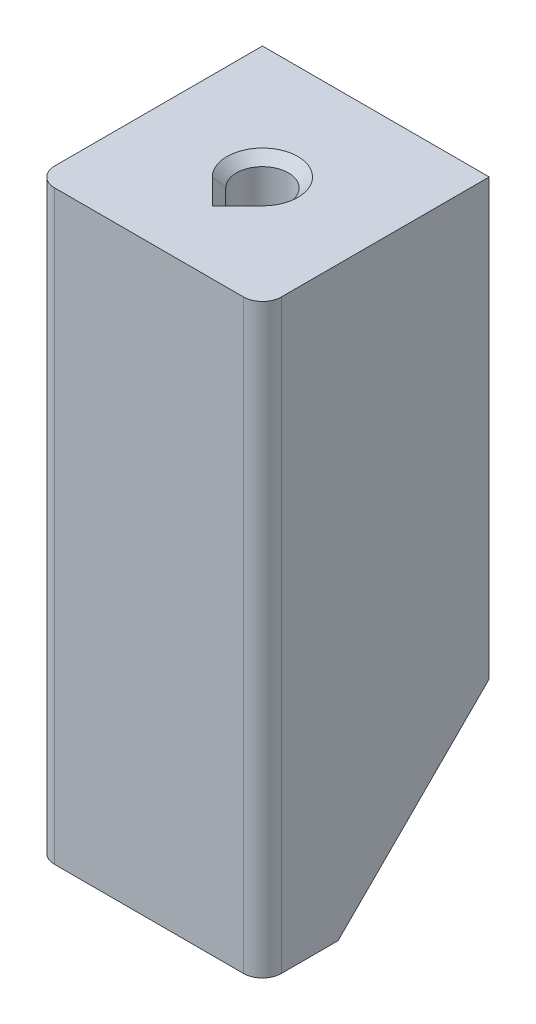
from build123d import *

# Parameters (mm, degrees)
BOSS_EXTRUDE1_DEPTH      = 12
BOSS_EXTRUDE1_DEPTH_BACK = 12
FILLET1_R                = 2
CUT_EXTRUDE1_DEPTH       = 66.1459899
CHAMFER1_SIZE            = 1


with BuildPart() as part:
    # Sketch3 → Boss-Extrude1 (new, two sides: drawn at the far end of the back side and taken through both)
    with BuildSketch(Plane(origin=(0, 0, 0), x_dir=(0, 0, -1), z_dir=(1, 0, 0)).offset(-BOSS_EXTRUDE1_DEPTH_BACK)):
        Polygon((0, 62), (-8, 62), (-8, 0), (0, 0), (16, 16), (16, 62), align=None)
    extrude(amount=BOSS_EXTRUDE1_DEPTH + BOSS_EXTRUDE1_DEPTH_BACK)

    # Fillet1
    fillet1_edges = [part.edges().sort_by_distance(p)[0] for p in [
        (-12, 31, 8),
        (12, 31, 8),
    ]]
    fillet(fillet1_edges, radius=FILLET1_R)

    # Sketch4 → Cut-Extrude1 (cut, through all)
    with BuildSketch(Plane(origin=(0, 62, 0), x_dir=(1, 0, 0), z_dir=(0, 1, 0))):
        with BuildLine():
            Line((0, 0.110912703), (1.944543648, 2.055456352))
            ThreePointArc((1.944543648, 2.055456352), (0, 6.75), (-1.944543648, 2.055456352))
            Line((-1.944543648, 2.055456352), (0, 0.110912703))
        make_face()
    extrude(amount=-CUT_EXTRUDE1_DEPTH, mode=Mode.SUBTRACT)

    # Chamfer1
    chamfer1_edges = [part.edges().sort_by_distance(p)[0] for p in [
        (0.972271824, 62, -1.083184528),
        (-0.972271824, 62, -1.083184528),
        (0, 62, -6.75),
    ]]
    chamfer(chamfer1_edges, length=CHAMFER1_SIZE)


solid = part.part
